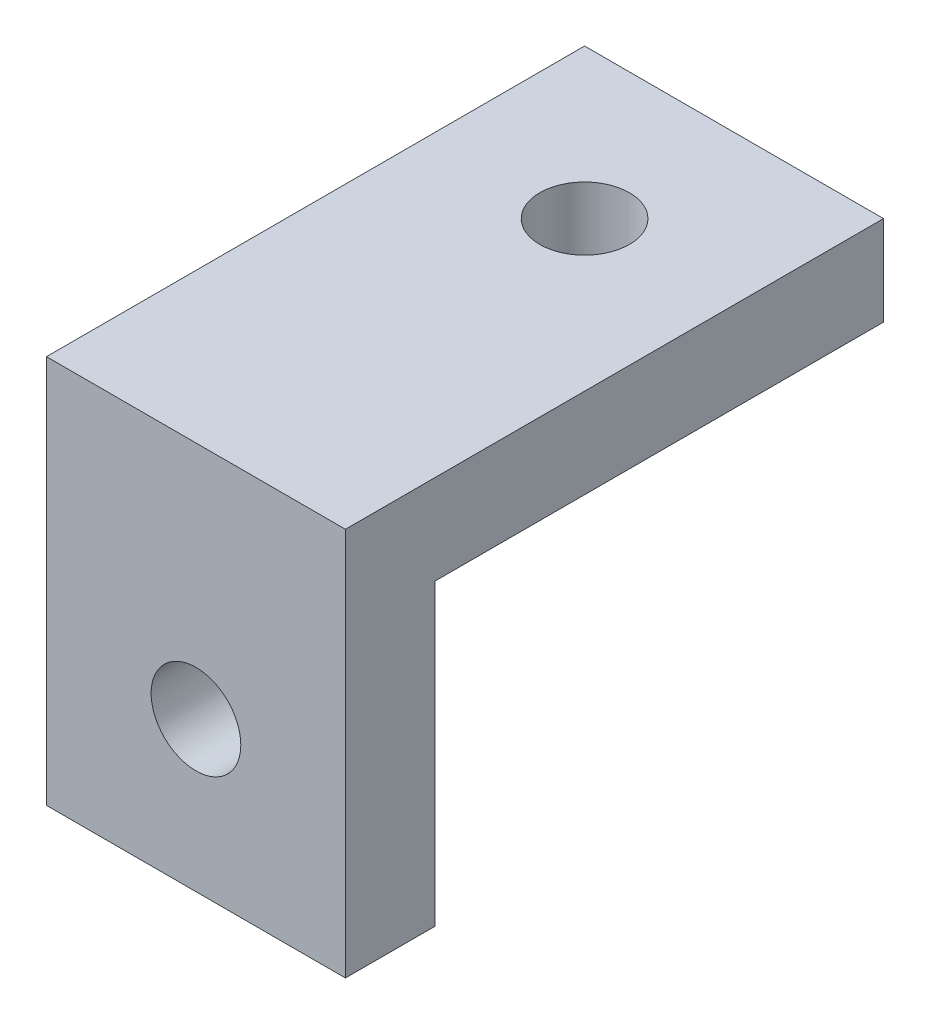
from build123d import *

# Parameters (mm, degrees)
SKETCH1_W           = 10
SKETCH1_H           = 18
SKETCH1_R           = 1.5
BOSS_EXTRUDE1_DEPTH = 3
SKETCH2_W           = 10
SKETCH2_H           = 3
BOSS_EXTRUDE2_DEPTH = 10
SKETCH3_R           = 1.5
CUT_EXTRUDE1_DEPTH  = 22.1896201


with BuildPart() as part:
    # Sketch1 → Boss-Extrude1 (new body)
    with BuildSketch(Plane(origin=(0, 0, 0), x_dir=(1, 0, 0), z_dir=(0, 1, 0))):
        with Locations((0, -4)):
            Rectangle(SKETCH1_W, SKETCH1_H)
        with Locations(Location((0, 0, 0), (0, 0, 270))):
            Circle(SKETCH1_R, mode=Mode.SUBTRACT)
    extrude(amount=BOSS_EXTRUDE1_DEPTH)

    # Sketch2 → Boss-Extrude2 (add)
    with BuildSketch(Plane.XZ):
        with Locations((0, 11.5)):
            Rectangle(SKETCH2_W, SKETCH2_H)
    extrude(amount=BOSS_EXTRUDE2_DEPTH)

    # Sketch3 → Cut-Extrude1 (cut, through all)
    with BuildSketch(Plane.XY.offset(13)):
        with Locations((0, -5)):
            Circle(SKETCH3_R)
    extrude(amount=-CUT_EXTRUDE1_DEPTH, mode=Mode.SUBTRACT)


solid = part.part
